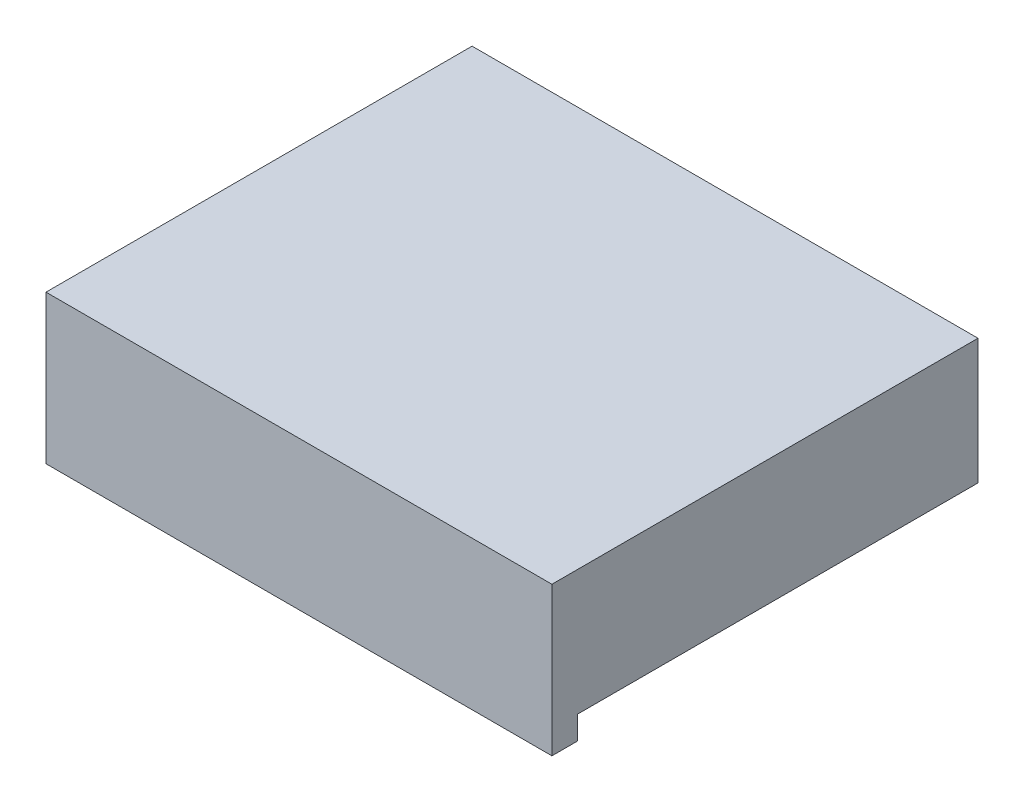
from build123d import *

# Parameters (mm, degrees)
SALIENTE_EXTRUIR1_DEPTH = 109


with BuildPart() as part:
    # Croquis1 → Saliente-Extruir1 (new body)
    with BuildSketch(Plane(origin=(0, 0, 0), x_dir=(0, 0, -1), z_dir=(1, 0, 0))):
        Polygon((0, 0), (-86.3, 0), (-86.3, -5.020979173), (-91.8, -5.020979173), (-91.8, 27), (0, 27), align=None)
    extrude(amount=SALIENTE_EXTRUIR1_DEPTH)


solid = part.part
